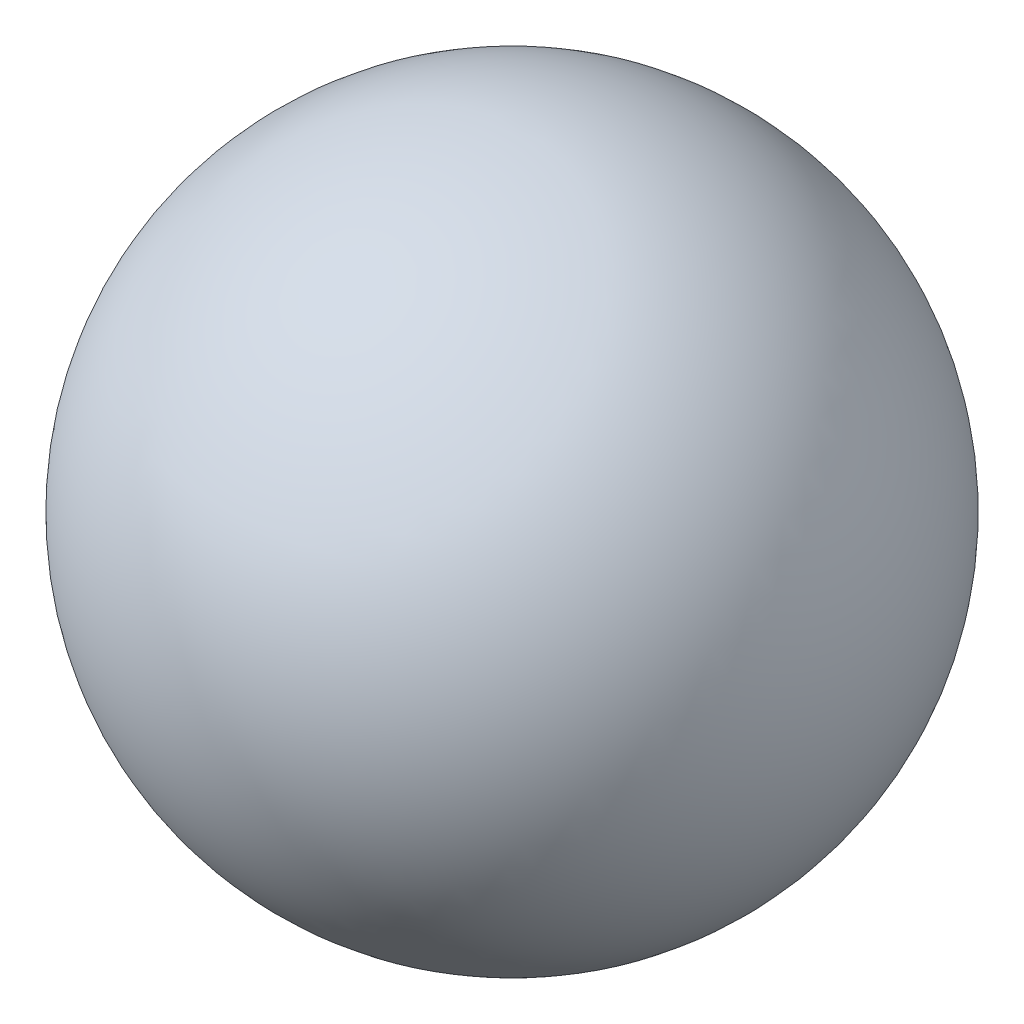
from build123d import *


with BuildPart() as part:
    # 草图1 → 旋转6 (revolve)
    with BuildSketch(Plane.XY):
        with BuildLine():
            Line((0, 21), (0, -21))
            ThreePointArc((0, -21), (21, 0), (0, 21))
        make_face()
    revolve(axis=Axis((0, 27.179596407, 0), (0, -1, 0)))


solid = part.part
